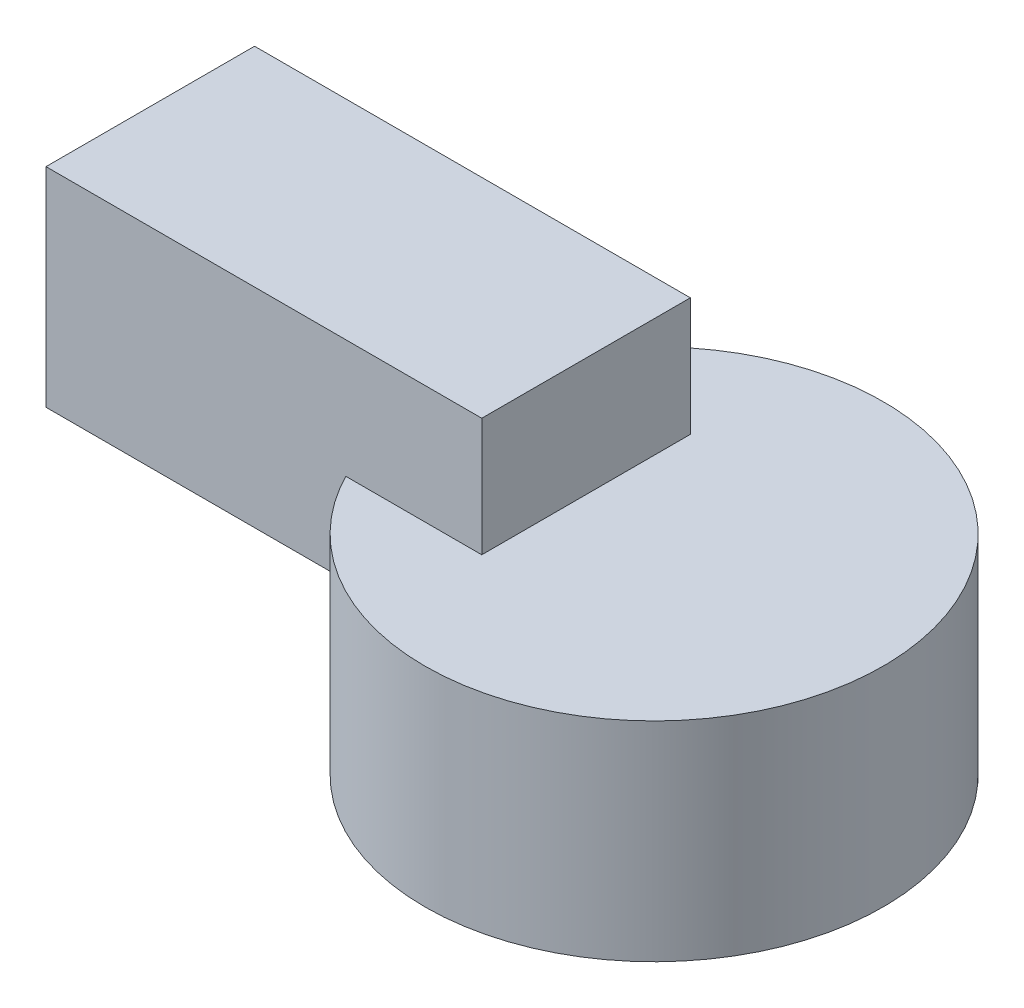
from build123d import *

# Parameters (mm, degrees)
SKETCH1_R           = 27.90389213
BOSS_EXTRUDE1_DEPTH = 12.7
SKETCH2_W           = 53.067899245
SKETCH2_H           = 25.382302614
BOSS_EXTRUDE2_DEPTH = 12.7


with BuildPart() as part:
    # Sketch1 → Boss-Extrude1 (new, symmetric)
    with BuildSketch(Plane(origin=(0, 0, 0), x_dir=(1, 0, 0), z_dir=(0, 1, 0))):
        with Locations(Location((0, 0, 0), (0, 0, 270))):
            Circle(SKETCH1_R)
    extrude(amount=BOSS_EXTRUDE1_DEPTH, both=True)


with BuildPart() as body_2:
    # Sketch2 → Boss-Extrude2 (new, symmetric)
    with BuildSketch(Plane.XY):
        with Locations((-34.820638145, 14.412890899)):
            Rectangle(SKETCH2_W, SKETCH2_H)
    extrude(amount=BOSS_EXTRUDE2_DEPTH, both=True)


solid = Compound([part.part, body_2.part])
